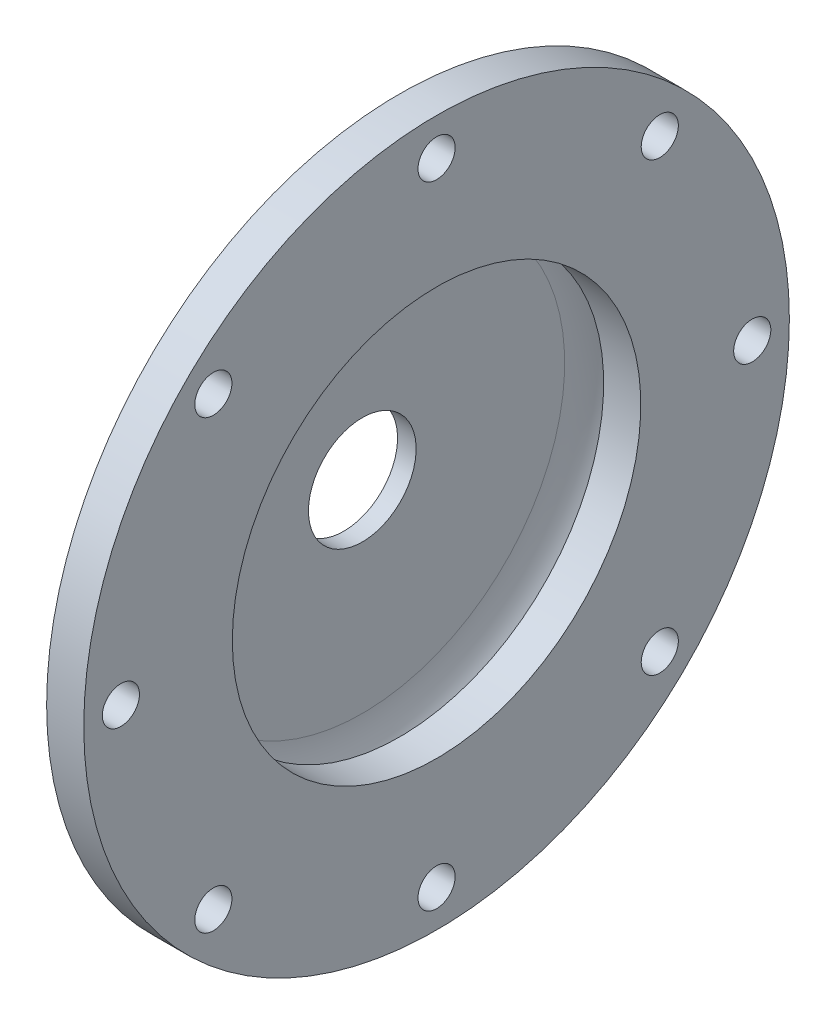
from build123d import *

# Parameters (mm, degrees)
SKETCH2_W               = 6.35
SKETCH2_H               = 25.4
CUT_EXTRUDE1_DEPTH      = 86.84251205
CUT_EXTRUDE1_DEPTH_BACK = 86.84251205
SKETCH3_R               = 3.175


with BuildPart() as part:
    # Sketch2 → Revolve1 (revolve)
    with BuildSketch(Plane.XY, mode=Mode.PRIVATE) as revolve1_sk:
        with BuildLine():
            ThreePointArc((-6.35, 34.6075), (-4.624734672, 40.464062692), (0, 44.45))
            Line((0, 44.45), (0, 47.625))
            ThreePointArc((0, 47.625), (-6.88946039, 42.67256248), (-9.525, 34.6075))
            Line((-9.525, 34.6075), (-9.525, 9.2075))
            Line((-9.525, 9.2075), (-6.35, 9.2075))
            Line((-6.35, 9.2075), (-6.35, 34.6075))
        make_face()
        with Locations((3.175, 47.625)):
            Rectangle(SKETCH2_W, SKETCH2_H)
    revolve(revolve1_sk.sketch.rotate(Axis((-978.527794003, 0, 0), (1, 0, 0)), 90), axis=Axis((-978.527794003, 0, 0), (1, 0, 0)))

    # Sketch3 → Cut-Extrude1 (cut, two sides: drawn at the far end of the back side and taken through both)
    with BuildSketch(Plane.ZY.offset(-CUT_EXTRUDE1_DEPTH_BACK)):
        with Locations((0, 53.975)):
            Circle(SKETCH3_R)
        with Locations((38.166088515, 38.166088515)):
            Circle(SKETCH3_R)
        with Locations((53.975, 0)):
            Circle(SKETCH3_R)
        with Locations((38.166088515, -38.166088515)):
            Circle(SKETCH3_R)
        with Locations((0, -53.975)):
            Circle(SKETCH3_R)
        with Locations((-38.166088515, -38.166088515)):
            Circle(SKETCH3_R)
        with Locations((-53.975, 0)):
            Circle(SKETCH3_R)
        with Locations((-38.166088515, 38.166088515)):
            Circle(SKETCH3_R)
    extrude(amount=CUT_EXTRUDE1_DEPTH + CUT_EXTRUDE1_DEPTH_BACK, mode=Mode.SUBTRACT)


solid = part.part
